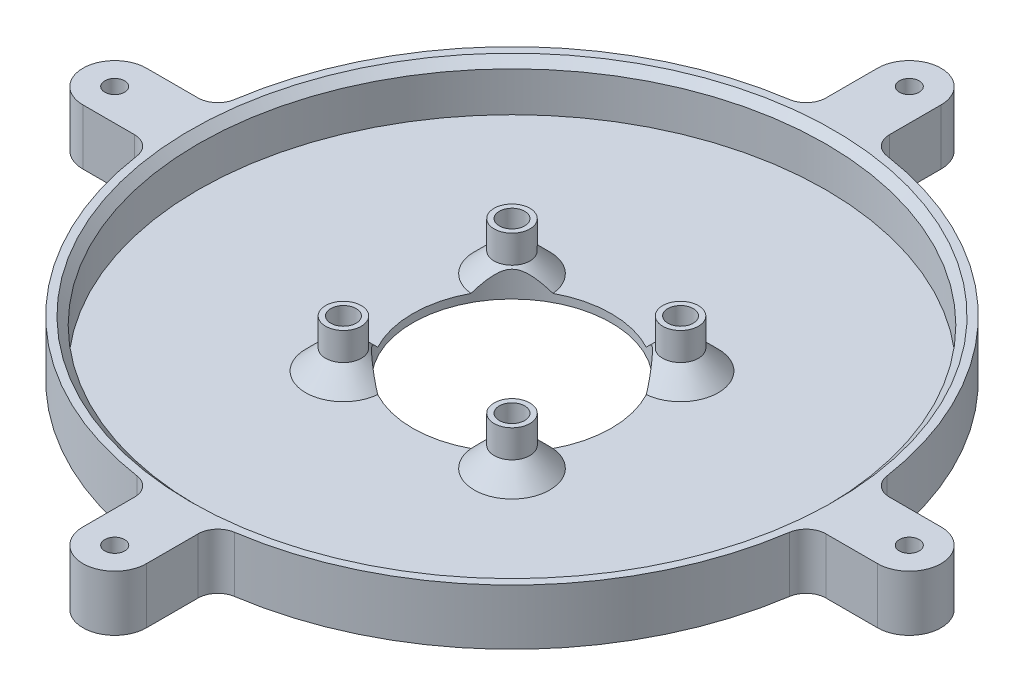
from build123d import *

# Parameters (mm, degrees)
SKETCH1_W                    = 8
SKETCH1_H                    = 8
BOSS_EXTRUDE1_DEPTH          = 7
SKETCH3_R                    = 39.5
CUT_EXTRUDE1_DEPTH           = 6
SKETCH5_R                    = 2.25
SKETCH5_R_2                  = 1.6
BOSS_EXTRUDE2_DEPTH          = 6
CHAMFER1_SIZE                = 2.5
CIRPATTERN1_COUNT            = 4
CHAMFER1_OF_CIRPATTERN1_SIZE = 2.5
CUT_EXTRUDE2_DEPTH           = 77.602872009
CUT_EXTRUDE2_DEPTH_BACK      = 77.602872009
SKETCH4_R                    = 12.5
M3X0_5_TAPPED_HOLE1_D        = 2.5
CHAMFER2_SIZE                = 1
FILLET1_R                    = 2.5
SKETCH8_R                    = 1.6
CUT_EXTRUDE3_DEPTH           = 77.602872009


with BuildPart() as part:
    # Sketch1 → Boss-Extrude1 (new body)
    with BuildSketch(Plane(origin=(0, 0, 0), x_dir=(1, 0, 0), z_dir=(0, 1, 0))):
        with BuildLine():
            Line((4, 41.306779105), (4, 50))
            ThreePointArc((4, 50), (0, 54), (-4, 50))
            Line((-4, 50), (-4, 41.306779105))
            ThreePointArc((-4, 41.306779105), (0, 41.5), (4, 41.306779105))
        make_face()
        with BuildLine():
            Line((50, 4), (41.306779105, 4))
            ThreePointArc((41.306779105, 4), (41.45166663, 2.002332035), (41.5, 0))
            ThreePointArc((41.5, 0), (41.45166663, -2.002332035), (41.306779105, -4))
            Line((41.306779105, -4), (50, -4))
            ThreePointArc((50, -4), (54, 0), (50, 4))
        make_face()
        with BuildLine():
            ThreePointArc((-41.306779105, -4), (-41.5, 0), (-41.306779105, 4))
            Line((-41.306779105, 4), (-50, 4))
            ThreePointArc((-50, 4), (-54, 0), (-50, -4))
            Line((-50, -4), (-41.306779105, -4))
        make_face()
        with BuildLine():
            Line((4, -50), (4, -41.306779105))
            ThreePointArc((4, -41.306779105), (0, -41.5), (-4, -41.306779105))
            Line((-4, -41.306779105), (-4, -50))
            ThreePointArc((-4, -50), (0, -54), (4, -50))
        make_face()
        with BuildLine():
            Line((41.306779105, -4), (4, -4))
            Line((4, -4), (4, -41.306779105))
            ThreePointArc((4, -41.306779105), (29.344931419, -29.344931419), (41.306779105, -4))
        make_face()
        with BuildLine():
            ThreePointArc((41.306779105, 4), (29.344931419, 29.344931419), (4, 41.306779105))
            Line((4, 41.306779105), (4, 4))
            Line((4, 4), (41.306779105, 4))
        make_face()
        with BuildLine():
            Line((-4, 4), (-4, 41.306779105))
            ThreePointArc((-4, 41.306779105), (-29.344931419, 29.344931419), (-41.306779105, 4))
            Line((-41.306779105, 4), (-4, 4))
        make_face()
        with BuildLine():
            Line((-4, -41.306779105), (-4, -4))
            Line((-4, -4), (-41.306779105, -4))
            ThreePointArc((-41.306779105, -4), (-29.344931419, -29.344931419), (-4, -41.306779105))
        make_face()
        with BuildLine():
            Line((41.306779105, 4), (4, 4))
            Line((4, 4), (4, -4))
            Line((4, -4), (41.306779105, -4))
            ThreePointArc((41.306779105, -4), (41.45166663, -2.002332035), (41.5, 0))
            ThreePointArc((41.5, 0), (41.45166663, 2.002332035), (41.306779105, 4))
        make_face()
        with BuildLine():
            Line((4, 4), (4, 41.306779105))
            ThreePointArc((4, 41.306779105), (0, 41.5), (-4, 41.306779105))
            Line((-4, 41.306779105), (-4, 4))
            Line((-4, 4), (4, 4))
        make_face()
        with BuildLine():
            Line((-4, -4), (-4, 4))
            Line((-4, 4), (-41.306779105, 4))
            ThreePointArc((-41.306779105, 4), (-41.5, 0), (-41.306779105, -4))
            Line((-41.306779105, -4), (-4, -4))
        make_face()
        with BuildLine():
            Line((4, -41.306779105), (4, -4))
            Line((4, -4), (-4, -4))
            Line((-4, -4), (-4, -41.306779105))
            ThreePointArc((-4, -41.306779105), (0, -41.5), (4, -41.306779105))
        make_face()
        Rectangle(SKETCH1_W, SKETCH1_H)
    extrude(amount=BOSS_EXTRUDE1_DEPTH)

    # Sketch3 → Cut-Extrude1 (cut)
    with BuildSketch(Plane(origin=(0, 7, 0), x_dir=(1, 0, 0), z_dir=(0, 1, 0))):
        with Locations(Location((0, 0, 0), (0, 0, 270))):
            Circle(SKETCH3_R)
    extrude(amount=-CUT_EXTRUDE1_DEPTH, mode=Mode.SUBTRACT)

    # Sketch5 → Boss-Extrude2 (add)
    with BuildSketch(Plane(origin=(0, 1, 0), x_dir=(1, 0, 0), z_dir=(0, 1, 0))):
        with Locations(Location((-10.606601718, 10.606601718, 0), (0, 0, 270))):
            Circle(SKETCH5_R)
        with Locations(Location((-10.606601718, 10.606601718, 0), (0, 0, 270))):
            Circle(SKETCH5_R_2, mode=Mode.SUBTRACT)
    boss_extrude2 = extrude(amount=BOSS_EXTRUDE2_DEPTH)

    # Chamfer1
    chamfer1_edges = [part.edges().sort_by_distance(p)[0] for p in [
        (-10.606601718, 1, -12.856601718),
    ]]
    chamfer(chamfer1_edges, length=CHAMFER1_SIZE)

    # CirPattern1: Boss-Extrude2 ×4 about axis
    cirpattern1_axis = Axis((0, 0, 0), (0, 1, 0))
    for i in range(1, CIRPATTERN1_COUNT):
        add(boss_extrude2.rotate(cirpattern1_axis, i * 360 / CIRPATTERN1_COUNT))

    # Chamfer1 of CirPattern1
    chamfer1_of_cirpattern1_edges = [part.edges().sort_by_distance(p)[0] for p in [
        (-12.856601718, 1, 10.606601718),
        (10.606601718, 1, 12.856601718),
        (12.856601718, 1, -10.606601718),
    ]]
    chamfer(chamfer1_of_cirpattern1_edges, length=CHAMFER1_OF_CIRPATTERN1_SIZE)

    # Sketch4 → Cut-Extrude2 (cut, two sides: drawn at the far end of the back side and taken through both)
    with BuildSketch(Plane(origin=(0, 1, 0), x_dir=(1, 0, 0), z_dir=(0, 1, 0)).offset(-CUT_EXTRUDE2_DEPTH_BACK)):
        with Locations(Location((0, 0, 0), (0, 0, 270))):
            Circle(SKETCH4_R)
    extrude(amount=CUT_EXTRUDE2_DEPTH + CUT_EXTRUDE2_DEPTH_BACK, mode=Mode.SUBTRACT)

    # M3x0.5 Tapped Hole1 (through all)
    with Locations(Plane(origin=(0, 7, 0), x_dir=(1, 0, 0), z_dir=(0, 1, 0))):
        with Locations((0, 50), (50, 0), (-50, 0), (0, -50)):
            Hole(M3X0_5_TAPPED_HOLE1_D / 2)

    # Chamfer2
    chamfer2_edges = [part.edges().sort_by_distance(p)[0] for p in [
        (0, 7, -39.5),
    ]]
    chamfer(chamfer2_edges, length=CHAMFER2_SIZE)

    # Fillet1
    fillet1_edges = [part.edges().sort_by_distance(p)[0] for p in [
        (4, 3.5, 41.306779105),
        (-4, 3.5, 41.306779105),
        (-41.306779105, 3.5, 4),
        (-41.306779105, 3.5, -4),
        (-4, 3.5, -41.306779105),
        (4, 3.5, -41.306779105),
        (41.306779105, 3.5, -4),
        (41.306779105, 3.5, 4),
    ]]
    fillet(fillet1_edges, radius=FILLET1_R)

    # Sketch8 → Cut-Extrude3 (cut, through all)
    with BuildSketch(Plane(origin=(0, 1, 0), x_dir=(1, 0, 0), z_dir=(0, 1, 0))):
        with Locations(Location((10.606601718, 10.606601718, 0), (0, 0, 270))):
            Circle(SKETCH8_R)
        with Locations(Location((-10.606601718, 10.606601718, 0), (0, 0, 270))):
            Circle(SKETCH8_R)
        with Locations(Location((-10.606601718, -10.606601718, 0), (0, 0, 270))):
            Circle(SKETCH8_R)
        with Locations(Location((10.606601718, -10.606601718, 0), (0, 0, 270))):
            Circle(SKETCH8_R)
    extrude(amount=-CUT_EXTRUDE3_DEPTH, mode=Mode.SUBTRACT)


solid = part.part
